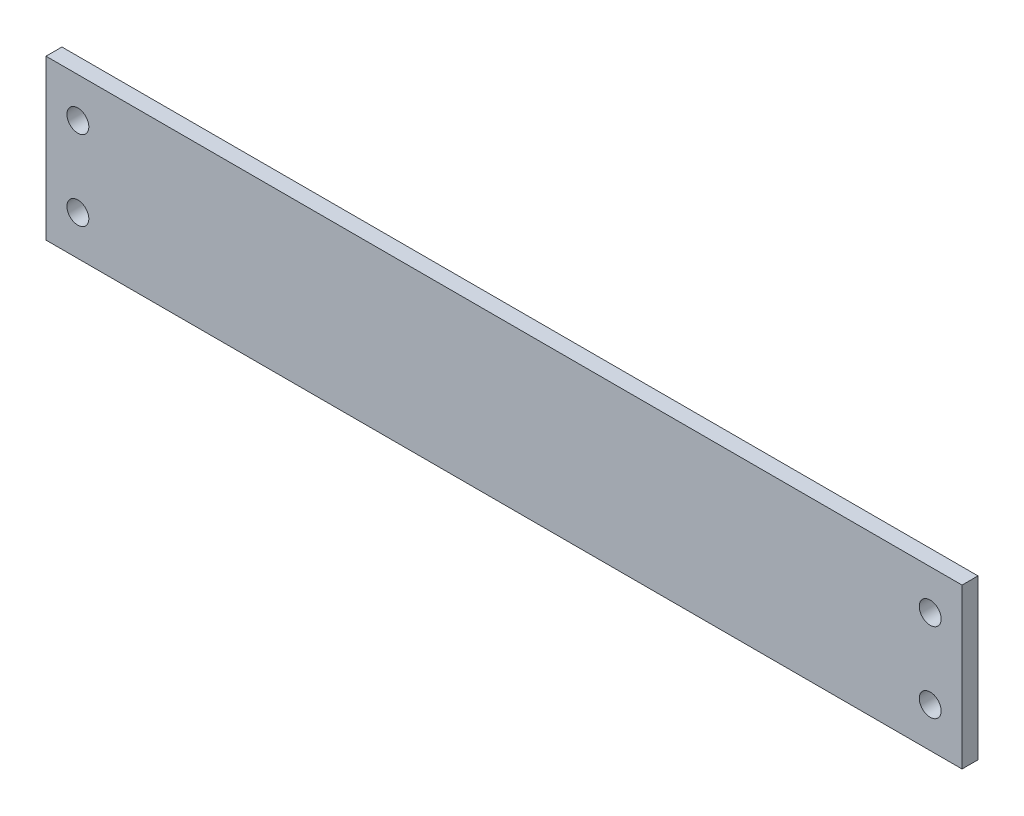
from build123d import *

# Parameters (mm, degrees)
EXTRUSION_BASE_SKETCH_W      = 230
EXTRUSION_BASE_SKETCH_H      = 40
EXTRUSION_BASE_EXTRUDE_DEPTH = 4
M5_MOUNTING_HOLES_D          = 5.5


with BuildPart() as part:
    # Extrusion Base Sketch → Extrusion Base Extrude (new body)
    with BuildSketch(Plane.XY):
        with Locations((93.75, 16.75)):
            Rectangle(EXTRUSION_BASE_SKETCH_W, EXTRUSION_BASE_SKETCH_H)
    extrude(amount=-EXTRUSION_BASE_EXTRUDE_DEPTH)

    # M5 Mounting Holes (through all)
    with Locations(Plane(origin=(0, 0, -4), x_dir=(-1, 0, 0), z_dir=(0, 0, -1))):
        with Locations((-200.75, 26.75), (-200.75, 6.75), (13.25, 26.75), (13.25, 6.75)):
            Hole(M5_MOUNTING_HOLES_D / 2)


solid = part.part
